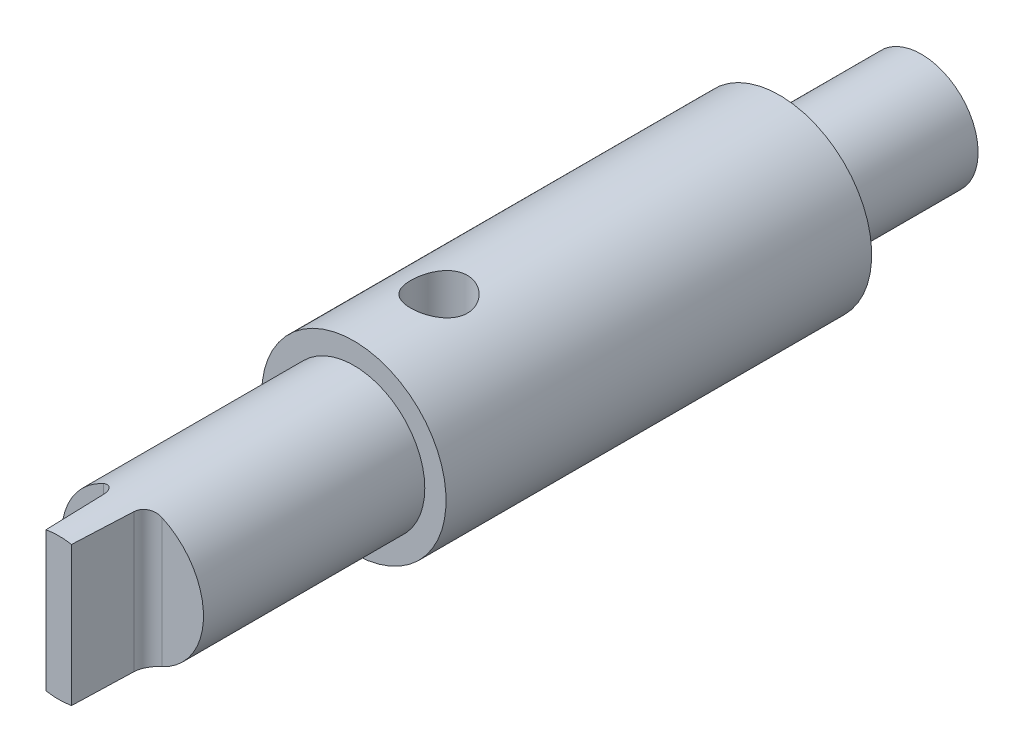
from build123d import *

# Parameters (mm, degrees)
SKETCH_1_R               = 2.5
EXTRUDE_1_DEPTH          = 10.4
SKETCH_2_R               = 3.25
EXTRUDE_2_DEPTH          = 15
CUT_EXTRUDE_1_DEPTH      = 16.68837149
CUT_EXTRUDE_1_DEPTH_BACK = 16.68837149
FILLET_1_R               = 0.5
CUT_EXTRUDE_2_DEPTH      = 16.68837149
CUT_EXTRUDE_2_DEPTH_BACK = 16.68837149
SKETCH_5_R               = 1
SKETCH_6_R               = 2
EXTRUDE_3_DEPTH          = 5


with BuildPart() as part:
    # Эскиз1 → Бобышка-Вытянуть1 (new body)
    with BuildSketch(Plane.XY):
        Circle(SKETCH_1_R)
    extrude(amount=EXTRUDE_1_DEPTH)

    # Эскиз2 → Бобышка-Вытянуть2 (add)
    with BuildSketch(Plane(origin=(0, 0, 0), x_dir=(-1, 0, 0), z_dir=(0, 0, -1))):
        Circle(SKETCH_2_R)
    extrude(amount=EXTRUDE_2_DEPTH)

    # Эскиз4 → Вырез-Вытянуть1 (cut, two sides: drawn at the far end of the back side and taken through both)
    with BuildSketch(Plane(origin=(0, 0, 0), x_dir=(1, 0, 0), z_dir=(0, 1, 0)).offset(-CUT_EXTRUDE_1_DEPTH_BACK)):
        Polygon((-0.45, -10.4), (-0.55, -7.8), (-2.5, -7.8), (-2.5, -10.4), align=None)
        Polygon((0.45, -10.4), (0.55, -7.8), (2.5, -7.8), (2.5, -10.4), align=None)
    extrude(amount=CUT_EXTRUDE_1_DEPTH + CUT_EXTRUDE_1_DEPTH_BACK, mode=Mode.SUBTRACT)

    # Скругление1
    fillet_1_edges = [part.edges().sort_by_distance(p)[0] for p in [
        (0.55, 0, 7.8),
        (-0.55, 0, 7.8),
    ]]
    fillet(fillet_1_edges, radius=FILLET_1_R)

    # Эскиз5 → Вырез-Вытянуть2 (cut, two sides: drawn at the far end of the back side and taken through both)
    with BuildSketch(Plane(origin=(0, 0, 0), x_dir=(1, 0, 0), z_dir=(0, 1, 0)).offset(-CUT_EXTRUDE_2_DEPTH_BACK)):
        with Locations(Location((0, 3, 0), (0, 0, 270))):
            Circle(SKETCH_5_R)
    extrude(amount=CUT_EXTRUDE_2_DEPTH + CUT_EXTRUDE_2_DEPTH_BACK, mode=Mode.SUBTRACT)

    # Эскиз6 → Бобышка-Вытянуть3 (add)
    with BuildSketch(Plane(origin=(0, 0, -15), x_dir=(-1, 0, 0), z_dir=(0, 0, -1))):
        Circle(SKETCH_6_R)
    extrude(amount=EXTRUDE_3_DEPTH)


solid = part.part
